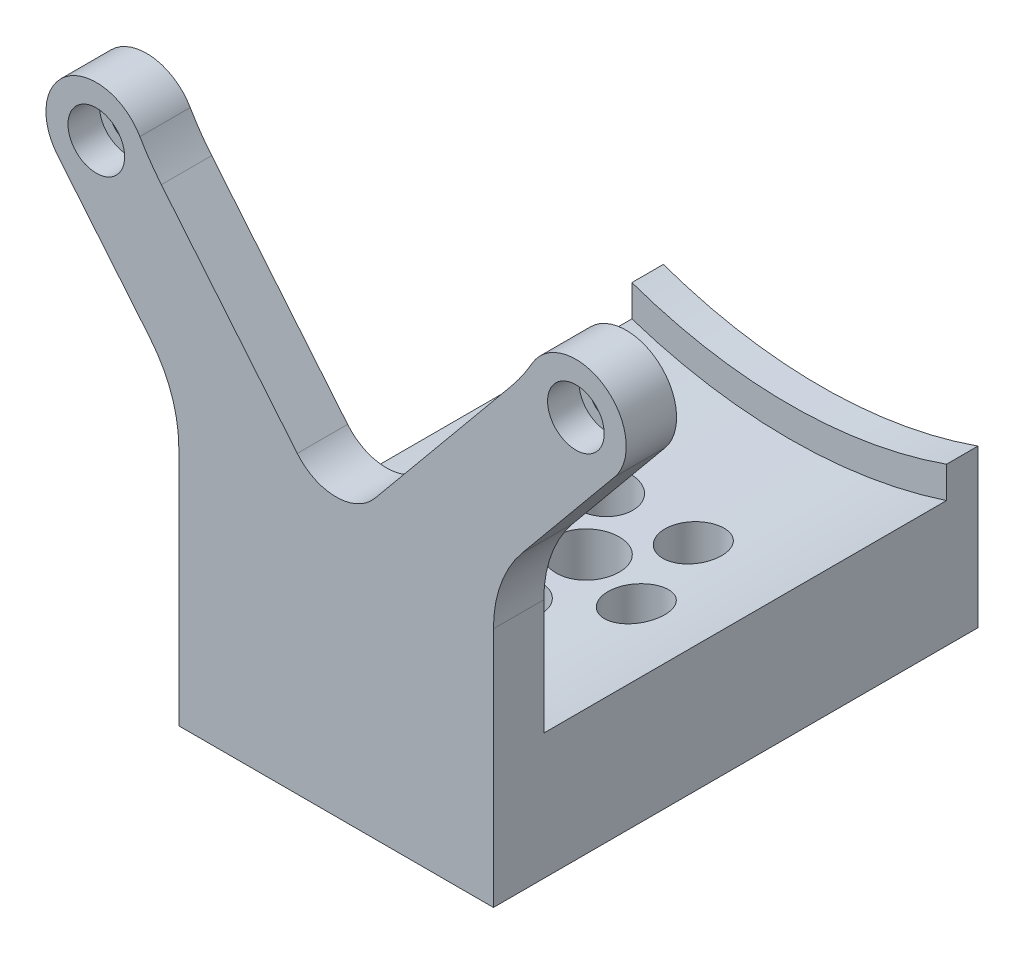
from build123d import *

# Parameters (mm, degrees)
BOSS_EXTRUDE1_DEPTH = 64
BOSS_EXTRUDE2_DEPTH = 5
SKETCH5_R           = 2.75
BOSS_EXTRUDE3_DEPTH = 8
SKETCH6_R           = 4.5
CUT_EXTRUDE1_DEPTH  = 5
SKETCH7_R           = 2.75
SKETCH7_R_2         = 5
CUT_EXTRUDE2_DEPTH  = 131.241540308
SKETCH8_R           = 4.5
CUT_EXTRUDE3_DEPTH  = 14
FILLET2_R           = 20


with BuildPart() as part:
    # Sketch3 → Boss-Extrude1 (new body)
    with BuildSketch(Plane.XY):
        with BuildLine():
            Line((0, 0), (50, 0))
            Line((50, 0), (50, 20))
            ThreePointArc((50, 20), (25, 15.993420768), (0, 20))
            Line((0, 20), (0, 0))
        make_face()
    extrude(amount=BOSS_EXTRUDE1_DEPTH)

    # Sketch4 → Boss-Extrude2 (add)
    with BuildSketch(Plane(origin=(0, 0, 0), x_dir=(-1, 0, 0), z_dir=(0, 0, -1))):
        with BuildLine():
            Line((-50, 0), (0, 0))
            Line((0, 0), (0, 25))
            ThreePointArc((0, 25), (-25, 20.726789434), (-50, 25))
            Line((-50, 25), (-50, 0))
        make_face()
    extrude(amount=BOSS_EXTRUDE2_DEPTH)

    # Sketch5 → Boss-Extrude3 (add)
    with BuildSketch(Plane.XY.offset(64)):
        with BuildLine():
            Line((0, 0), (50, 0))
            Line((50, 0), (50, 45.536190526))
            Line((50, 45.536190526), (69.276231493, 68.902511677))
            ThreePointArc((69.276231493, 68.902511677), (67.66630765, 80.565752686), (56.176914536, 77.993420768))
            ThreePointArc((56.176914536, 77.993420768), (54.575493633, 75.468066292), (52.77001177, 73.084329859))
            Line((52.77001177, 73.084329859), (31.171113727, 46.902511677))
            ThreePointArc((31.171113727, 46.902511677), (25, 43.993420768), (18.828886273, 46.902511677))
            Line((18.828886273, 46.902511677), (-2.77001177, 73.084329859))
            ThreePointArc((-2.77001177, 73.084329859), (-4.575493633, 75.468066292), (-6.176914536, 77.993420768))
            ThreePointArc((-6.176914536, 77.993420768), (-17.66630765, 80.565752686), (-19.276231493, 68.902511677))
            Line((-19.276231493, 68.902511677), (0, 45.536190526))
            Line((0, 45.536190526), (0, 0))
        make_face()
        with Locations((63.105117767, 73.993420768)):
            Circle(SKETCH5_R, mode=Mode.SUBTRACT)
        with Locations((-13.105117767, 73.993420768)):
            Circle(SKETCH5_R, mode=Mode.SUBTRACT)
    extrude(amount=BOSS_EXTRUDE3_DEPTH)

    # Sketch6 → Cut-Extrude1 (cut)
    with BuildSketch(Plane.XY.offset(72)):
        with Locations((-13.105117767, 73.993420768)):
            Circle(SKETCH6_R)
        with Locations((63.105117767, 73.993420768)):
            Circle(SKETCH6_R)
    extrude(amount=-CUT_EXTRUDE1_DEPTH, mode=Mode.SUBTRACT)

    # Sketch7 → Cut-Extrude2 (cut, through all)
    with BuildSketch(Plane.XZ):
        with Locations(Location((25, 44, 0), (0, 0, 270))):
            Circle(SKETCH7_R)
        with Locations(Location((36.412678196, 35.708203932, 0), (0, 0, 270))):
            Circle(SKETCH7_R)
        with Locations(Location((32.053423028, 22.291796068, 0), (0, 0, 270))):
            Circle(SKETCH7_R)
        with Locations(Location((17.946576972, 22.291796068, 0), (0, 0, 270))):
            Circle(SKETCH7_R)
        with Locations(Location((13.587321804, 35.708203932, 0), (0, 0, 270))):
            Circle(SKETCH7_R)
        with Locations(Location((25, 32, 0), (0, 0, 270))):
            Circle(SKETCH7_R_2)
    extrude(amount=-CUT_EXTRUDE2_DEPTH, mode=Mode.SUBTRACT)

    # Sketch8 → Cut-Extrude3 (cut)
    with BuildSketch(Plane(origin=(0, 20, 0), x_dir=(1, 0, 0), z_dir=(0, 1, 0))):
        with Locations(Location((25, -44, 0), (0, 0, 180))):
            Circle(SKETCH8_R)
        with Locations(Location((17.946576972, -22.291796068, 0), (0, 0, 180))):
            Circle(SKETCH8_R)
        with Locations(Location((32.053423028, -22.291796068, 0), (0, 0, 180))):
            Circle(SKETCH8_R)
        with Locations(Location((36.412678196, -35.708203932, 0), (0, 0, 180))):
            Circle(SKETCH8_R)
        with Locations(Location((13.587321804, -35.708203932, 0), (0, 0, 180))):
            Circle(SKETCH8_R)
    extrude(amount=-CUT_EXTRUDE3_DEPTH, mode=Mode.SUBTRACT)

    # Fillet2
    fillet2_edges = [part.edges().sort_by_distance(p)[0] for p in [
        (0, 45.536190526, 68),
        (50, 45.536190526, 68),
    ]]
    fillet(fillet2_edges, radius=FILLET2_R)


solid = part.part
